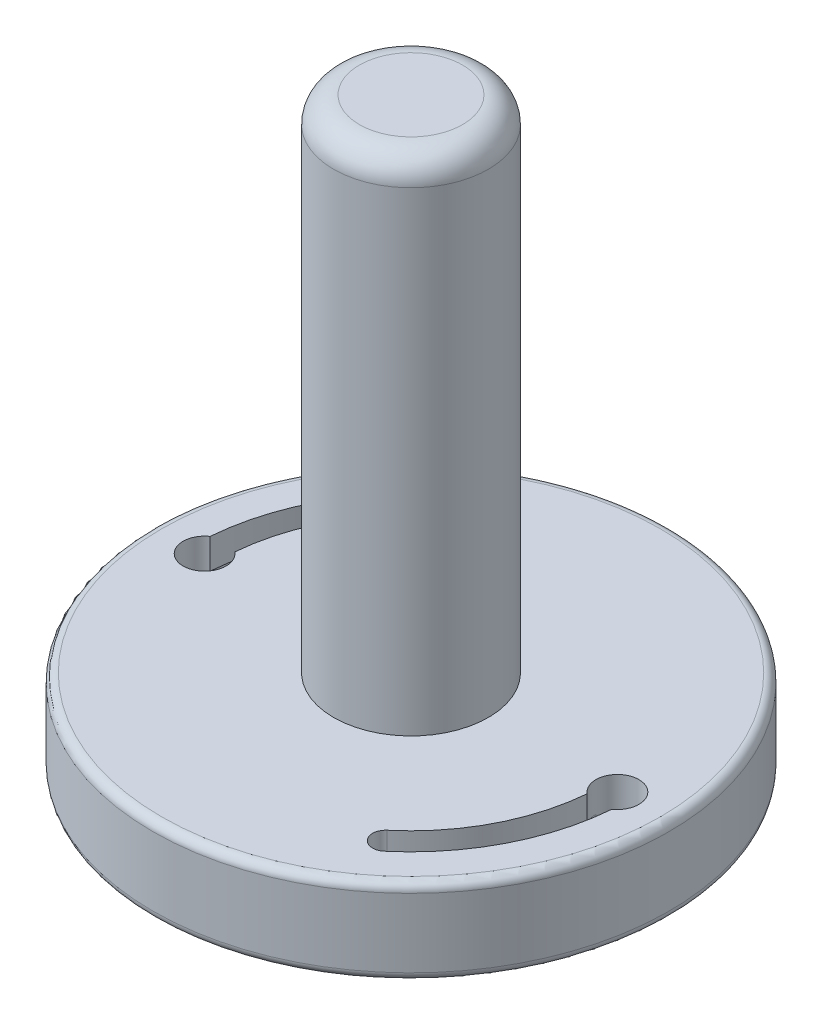
from build123d import *

# Parameters (mm, degrees)
SKETCH1_R           = 38.1
BOSS_EXTRUDE1_DEPTH = 12.7
SKETCH2_R           = 11.43
BOSS_EXTRUDE2_DEPTH = 73.914
FILLET1_R           = 1.27
FILLET2_R           = 1.27
FILLET3_R           = 3.81
CUT_EXTRUDE1_DEPTH  = 4.445
CUT_EXTRUDE2_DEPTH  = 3.175


with BuildPart() as part:
    # Sketch1 → Boss-Extrude1 (new body)
    with BuildSketch(Plane(origin=(0, 0, 0), x_dir=(1, 0, 0), z_dir=(0, 1, 0))):
        with Locations(Location((0, 0, 0), (0, 0, 270))):
            Circle(SKETCH1_R)
    extrude(amount=BOSS_EXTRUDE1_DEPTH)

    # Sketch2 → Boss-Extrude2 (add)
    with BuildSketch(Plane(origin=(0, 12.7, 0), x_dir=(1, 0, 0), z_dir=(0, 1, 0))):
        with Locations(Location((0, 0, 0), (0, 0, 270))):
            Circle(SKETCH2_R)
    extrude(amount=BOSS_EXTRUDE2_DEPTH)

    # Fillet1
    fillet1_edges = [part.edges().sort_by_distance(p)[0] for p in [
        (0, 12.7, -38.1),
    ]]
    fillet(fillet1_edges, radius=FILLET1_R)

    # Fillet2
    fillet2_edges = [part.edges().sort_by_distance(p)[0] for p in [
        (0, 0, -38.1),
    ]]
    fillet(fillet2_edges, radius=FILLET2_R)

    # Fillet3
    fillet3_edges = [part.edges().sort_by_distance(p)[0] for p in [
        (0, 86.614, -11.43),
    ]]
    fillet(fillet3_edges, radius=FILLET3_R)

    # Sketch4 → Cut-Extrude1 (cut)
    with BuildSketch(Plane(origin=(0, 12.7, 0), x_dir=(1, 0, 0), z_dir=(0, 1, 0))):
        with BuildLine():
            ThreePointArc((-32.279166667, 2.616032168), (-30.612356486, -3.172240023), (-28.469166667, 2.457066199))
            ThreePointArc((-28.469166667, 2.457066199), (-25.354072576, 13.179591374), (-18.367655947, 21.889719962))
            ThreePointArc((-18.367655947, 21.889719962), (-18.132851679, 24.573545023), (-20.81667674, 24.80834929))
            ThreePointArc((-20.81667674, 24.80834929), (-28.773544821, 14.861740929), (-32.279166667, 2.616032168))
        make_face()
        with BuildLine():
            ThreePointArc((32.279166667, -2.616032168), (30.612356486, 3.172240023), (28.469166667, -2.457066199))
            ThreePointArc((28.469166667, -2.457066199), (25.354072576, -13.179591374), (18.367655947, -21.889719962))
            ThreePointArc((18.367655947, -21.889719962), (18.132851679, -24.573545023), (20.81667674, -24.80834929))
            ThreePointArc((20.81667674, -24.80834929), (28.773544821, -14.861740929), (32.279166667, -2.616032168))
        make_face()
    extrude(amount=-CUT_EXTRUDE1_DEPTH, mode=Mode.SUBTRACT)

    # Sketch5 → Cut-Extrude2 (cut)
    with BuildSketch(Plane(origin=(0, 8.255, 0), x_dir=(1, 0, 0), z_dir=(0, 1, 0))):
        with BuildLine():
            ThreePointArc((-21.633017004, 25.781225733), (-30.501788573, 14.223217599), (-33.655, 0))
            ThreePointArc((-33.655, 0), (-30.48, -3.175), (-27.305, 0))
            ThreePointArc((-27.305, 0), (-24.746734125, 11.539591637), (-17.551315682, 20.916843519))
            ThreePointArc((-17.551315682, 20.916843519), (-17.159975236, 25.389885287), (-21.633017004, 25.781225733))
        make_face()
        with BuildLine():
            ThreePointArc((33.655, 0), (30.48, 3.175), (27.305, 0))
            ThreePointArc((27.305, 0), (24.746734125, -11.539591637), (17.551315682, -20.916843519))
            ThreePointArc((17.551315682, -20.916843519), (17.159975236, -25.389885287), (21.633017004, -25.781225733))
            ThreePointArc((21.633017004, -25.781225733), (30.501788573, -14.223217599), (33.655, 0))
        make_face()
    extrude(amount=-CUT_EXTRUDE2_DEPTH, mode=Mode.SUBTRACT)


solid = part.part
